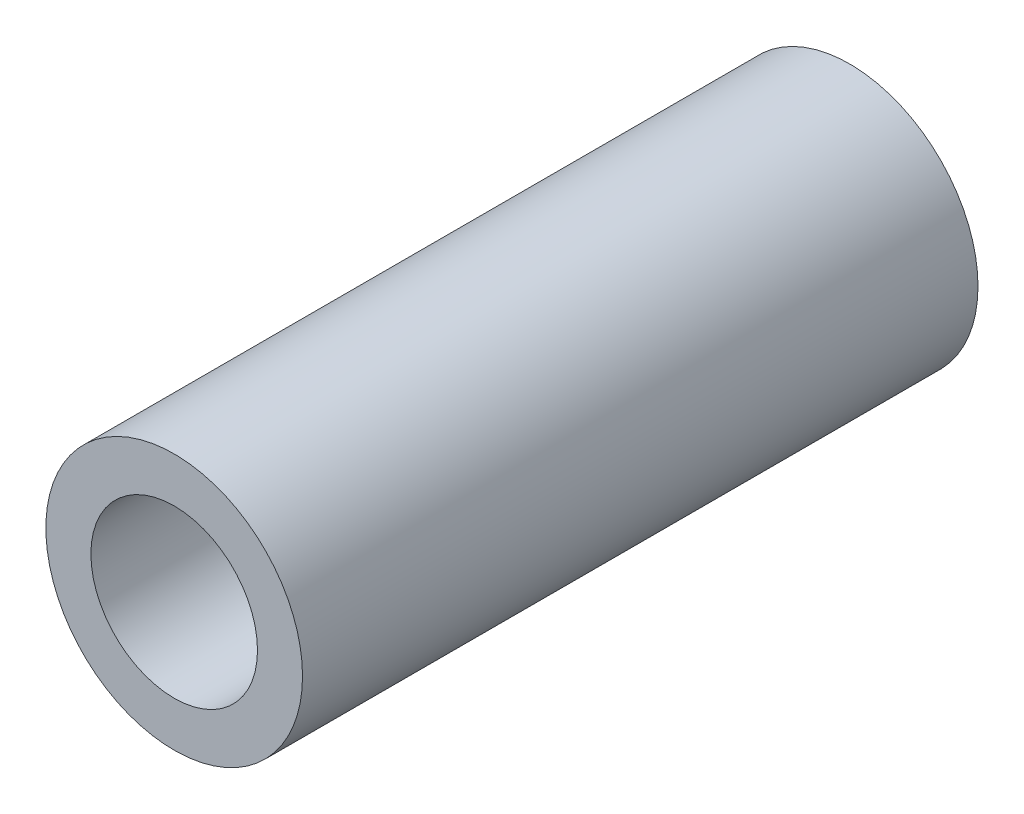
from build123d import *

# Parameters (mm, degrees)
SKETCH_1_R      = 2.85
SKETCH_1_R_2    = 1.85
EXTRUDE_1_DEPTH = 15


with BuildPart() as part:
    # Эскиз1 → Бобышка-Вытянуть1 (new body)
    with BuildSketch(Plane.XY):
        Circle(SKETCH_1_R)
        Circle(SKETCH_1_R_2, mode=Mode.SUBTRACT)
    extrude(amount=EXTRUDE_1_DEPTH)


solid = part.part
